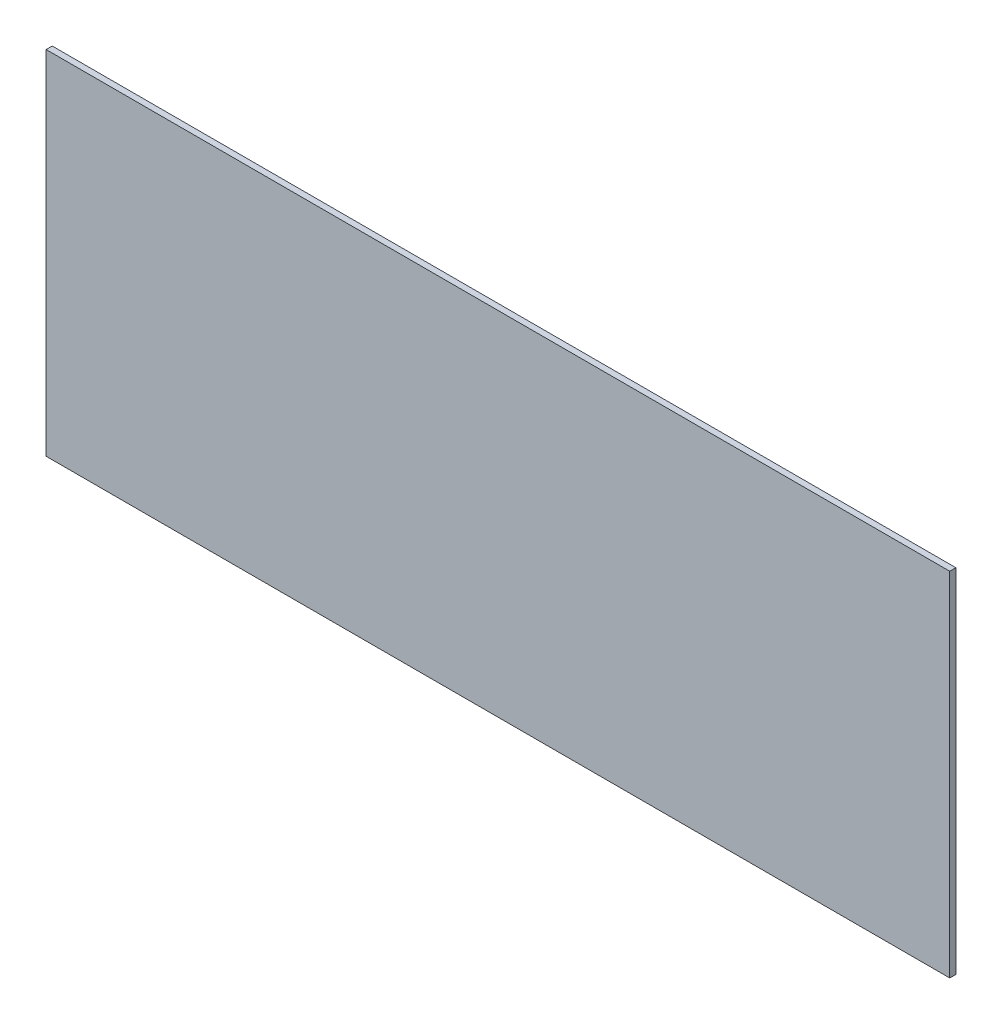
from build123d import *

# Parameters (mm, degrees)
FKAP_CAM_DIS_4MM_1_START = 34
SKETCH1_W                = 590
SKETCH1_H                = 230
FKAP_CAM_DIS_4MM_1_DEPTH = 4


with BuildPart() as part:
    # Sketch1 → FKAP_cam_dis_4mm_1 (new body)
    with BuildSketch(Plane.XY.offset(FKAP_CAM_DIS_4MM_1_START)):
        with Locations((320, 140)):
            Rectangle(SKETCH1_W, SKETCH1_H)
    extrude(amount=FKAP_CAM_DIS_4MM_1_DEPTH)


solid = part.part
